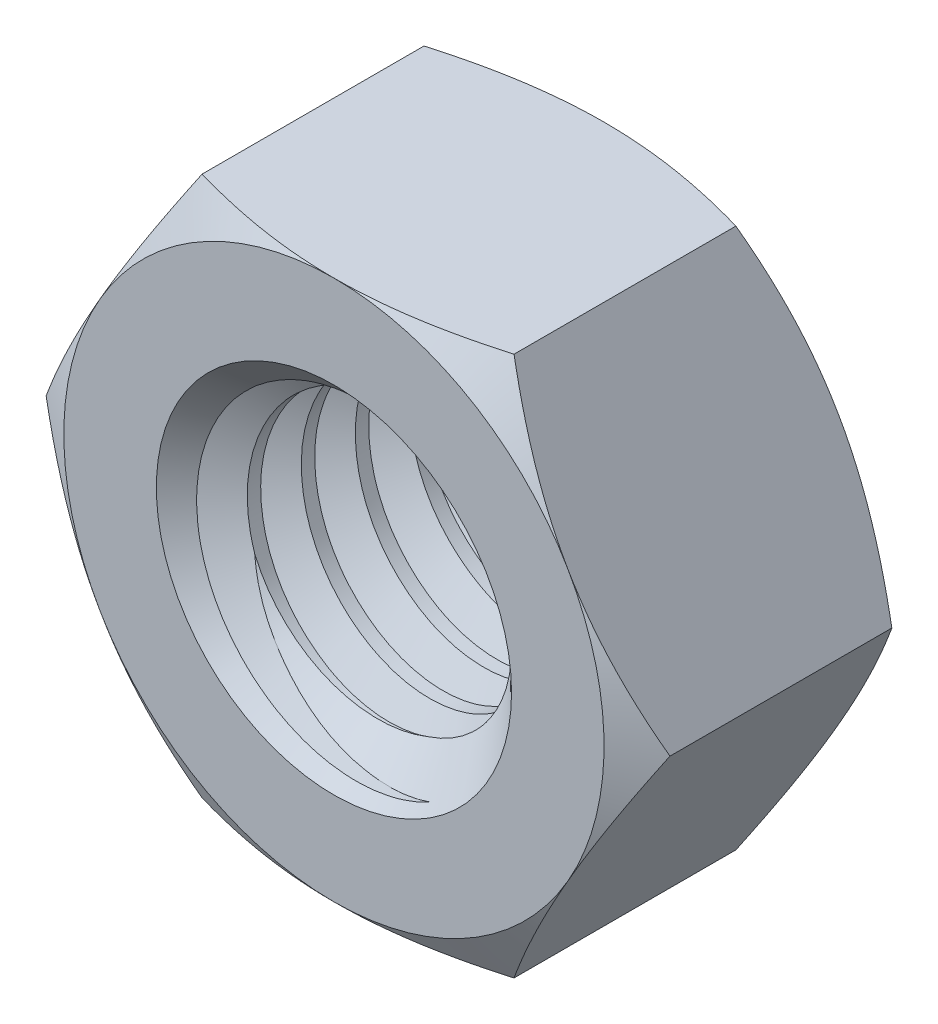
from build123d import *

# Parameters (mm, degrees)
BOSS_EXTRUDE1_DEPTH = 4
IZIM2_OUTSIDE_W     = 27.666
IZIM2_OUTSIDE_H     = 26.428
IZIM2_OUTSIDE_R     = 4
CUT_EXTRUDE1_DEPTH  = 4
CUT_EXTRUDE1_DRAFT  = -60
IZIM3_OUTSIDE_W     = 27.666
IZIM3_OUTSIDE_H     = 26.428
IZIM3_OUTSIDE_R     = 4
CUT_EXTRUDE2_DEPTH  = 4
CUT_EXTRUDE2_DRAFT  = -60
IZIM4_R             = 1.98
CUT_EXTRUDE3_DEPTH  = 4
CHAMFER1_SIZE       = 0.65
CUT_SWEPT1_PITCH    = 0.8
CUT_SWEPT1_HEIGHT   = 5
CUT_SWEPT1_RADIUS   = 1.98


with BuildPart() as part:
    # Çizim1 → Boss-Extrude1 (new body)
    with BuildSketch(Plane.XY):
        Polygon((4.618802154, 0), (2.309401077, 4), (-2.309401077, 4), (-4.618802154, 0), (-2.309401077, -4), (2.309401077, -4), align=None)
    extrude(amount=BOSS_EXTRUDE1_DEPTH)


with BuildPart() as cut_extrude1_tool:
    # Çizim2 outside → Cut-Extrude1 (with draft: the straight prism first)
    with BuildSketch(Plane.XY.offset(4)):
        Rectangle(IZIM2_OUTSIDE_W, IZIM2_OUTSIDE_H)
        Circle(IZIM2_OUTSIDE_R, mode=Mode.SUBTRACT)
    extrude(amount=-CUT_EXTRUDE1_DEPTH)
    # Cut-Extrude1: the draft: its side faces are tilted about the plane it starts from
    cut_extrude1_sides = [cut_extrude1_tool.faces().sort_by_distance(p)[0] for p in [
        (0, -13.214, 2),
        (13.833, 0, 2),
        (0, 13.214, 2),
        (-13.833, 0, 2),
        (-4, 0, 2),
    ]]
    draft(cut_extrude1_sides, Plane.XY.offset(4), CUT_EXTRUDE1_DRAFT)


with BuildPart() as part_1:
    add(part.part)

    # Cut-Extrude1: cut by cut_extrude1_tool
    add(cut_extrude1_tool.part, mode=Mode.SUBTRACT)


with BuildPart() as cut_extrude2_tool:
    # Çizim3 outside → Cut-Extrude2 (with draft: the straight prism first)
    with BuildSketch(Plane(origin=(0, 0, 0), x_dir=(-1, 0, 0), z_dir=(0, 0, -1))):
        Rectangle(IZIM3_OUTSIDE_W, IZIM3_OUTSIDE_H)
        Circle(IZIM3_OUTSIDE_R, mode=Mode.SUBTRACT)
    extrude(amount=-CUT_EXTRUDE2_DEPTH)
    # Cut-Extrude2: the draft: its side faces are tilted about the plane it starts from
    cut_extrude2_sides = [cut_extrude2_tool.faces().sort_by_distance(p)[0] for p in [
        (0, -13.214, 2),
        (-13.833, 0, 2),
        (0, 13.214, 2),
        (13.833, 0, 2),
        (4, 0, 2),
    ]]
    draft(cut_extrude2_sides, Plane(origin=(0, 0, 0), x_dir=(-1, 0, 0), z_dir=(0, 0, -1)), CUT_EXTRUDE2_DRAFT)


with BuildPart() as part_2:
    add(part_1.part)

    # Cut-Extrude2: cut by cut_extrude2_tool
    add(cut_extrude2_tool.part, mode=Mode.SUBTRACT)

    # Çizim4 → Cut-Extrude3 (cut)
    with BuildSketch(Plane.XY.offset(4)):
        Circle(IZIM4_R)
    extrude(amount=-CUT_EXTRUDE3_DEPTH, mode=Mode.SUBTRACT)

    # Chamfer1
    chamfer1_edges = [part_2.edges().sort_by_distance(p)[0] for p in [
        (-1.98, 0, 0),
        (-1.98, 0, 4),
    ]]
    chamfer(chamfer1_edges, length=CHAMFER1_SIZE)

    # Cut-Swept1: sweep along a helix
    with BuildLine() as cut_swept1_path:
        Helix(CUT_SWEPT1_PITCH, CUT_SWEPT1_HEIGHT, CUT_SWEPT1_RADIUS, center=(0, 0, 0), direction=(0, 0, 1))
    # Çizim6 → Cut-Swept1 (sweep, cut)
    with BuildSketch(Plane(origin=(0, 1.98, 5), x_dir=(0.06417248340128018, 5.079204879135305e-15, 0.9979388219595992), z_dir=(-0.9979388219595992, -7.898612403512853e-14, 0.06417248340128018))):
        Polygon((0, 0.52), (-0.383328785, -0.143944932), (0.383328785, -0.143944932), align=None)
    sweep(path=cut_swept1_path.line, is_frenet=True, mode=Mode.SUBTRACT)


solid = part_2.part
